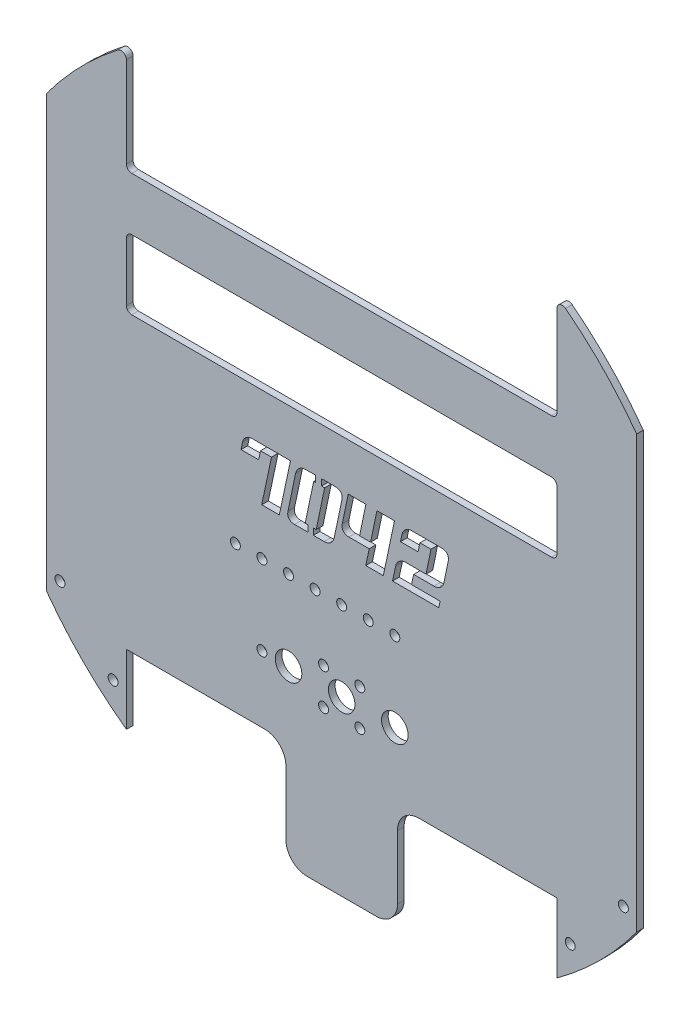
from build123d import *

# Parameters (mm, degrees)
SKETCH1_R               = 2.38125
BOSS_EXTRUDE1_DEPTH     = 3.175
BOSS_EXTRUDE2_DEPTH     = 50.8
CUT_EXTRUDE1_DEPTH      = 209.526843613
CUT_EXTRUDE1_DEPTH_BACK = 209.526843613
SKETCH3_R               = 203.829254644
SKETCH3_R_2             = 174.625
SKETCH5_R               = 2.38125
CUT_EXTRUDE3_DEPTH      = 200.484174202
SKETCH6_W               = 205.731089426
SKETCH6_H               = 25.4
BOSS_EXTRUDE3_DEPTH     = 3.175
SKETCH8_R               = 2.38125
CUT_EXTRUDE5_DEPTH      = 200.484174202
SKETCH9_W               = 205.731089426
SKETCH9_H               = 38.1
BOSS_EXTRUDE4_DEPTH     = 3.175
SKETCH10_R              = 6.35
SKETCH10_R_2            = 2.38125
CUT_EXTRUDE6_DEPTH      = 200.484174202
SKETCH11_W              = 53.331089426
SKETCH11_H              = 50.8
BOSS_EXTRUDE5_DEPTH     = 3.175
FILLET1_R               = 10.16
SKETCH12_R              = 6.35
SKETCH12_R_2            = 2.38125
CUT_EXTRUDE7_DEPTH      = 213.327407372
FILLET2_R               = 2.54
CUT_EXTRUDE8_DEPTH      = 213.327407372
SKETCH14_W              = 2.759281453
SKETCH14_H              = 7.963584416
SKETCH14_W_2            = 2.527010149
SKETCH14_H_2            = 5.938870156
BOSS_EXTRUDE6_DEPTH     = 3.175
FILLET3_R               = 2.54


with BuildPart() as part:
    # Sketch1 → Boss-Extrude1 (new body)
    with BuildSketch(Plane.XY):
        with BuildLine():
            Line((-102.865544713, 31.75), (-102.865544713, 145.022480019))
            ThreePointArc((-102.865544713, 145.022480019), (-123.286100955, 128.114703728), (-140.965544713, 108.358457002))
            Line((-140.965544713, 108.358457002), (-140.965544713, -108.358457002))
            ThreePointArc((-140.965544713, -108.358457002), (-123.286100955, -128.114703728), (-102.865544713, -145.022480019))
            Line((-102.865544713, -145.022480019), (-102.865544713, -69.85))
            Line((-102.865544713, -69.85), (102.865544713, -69.85))
            Line((102.865544713, -69.85), (102.865544713, -145.022480019))
            ThreePointArc((102.865544713, -145.022480019), (123.286100955, -128.114703728), (140.965544713, -108.358457002))
            Line((140.965544713, -108.358457002), (140.965544713, 108.358457002))
            ThreePointArc((140.965544713, 108.358457002), (123.286100955, 128.114703728), (102.865544713, 145.022480019))
            Line((102.865544713, 145.022480019), (102.865544713, 31.75))
            Line((102.865544713, 31.75), (-102.865544713, 31.75))
        make_face()
        with Locations((25.4, -38.1)):
            Circle(SKETCH1_R, mode=Mode.SUBTRACT)
        with Locations((-25.4, -38.1)):
            Circle(SKETCH1_R, mode=Mode.SUBTRACT)
        with Locations((0, -38.1)):
            Circle(SKETCH1_R, mode=Mode.SUBTRACT)
    extrude(amount=BOSS_EXTRUDE1_DEPTH)

    # Sketch2 → Boss-Extrude2 (add)
    with BuildSketch(Plane.XY.offset(3.175)):
        with BuildLine():
            ThreePointArc((-102.865544713, -141.111907137), (-123.390730203, -123.566250752), (-140.965544713, -103.06602655))
            Line((-140.965544713, -103.06602655), (-140.965544713, -108.358457002))
            ThreePointArc((-140.965544713, -108.358457002), (-123.286100955, -128.114703728), (-102.865544713, -145.022480019))
            Line((-102.865544713, -145.022480019), (-102.865544713, -141.111907137))
        make_face()
        with BuildLine():
            ThreePointArc((140.965544713, -103.06602655), (123.390730203, -123.566250752), (102.865544713, -141.111907137))
            Line((102.865544713, -141.111907137), (102.865544713, -145.022480019))
            ThreePointArc((102.865544713, -145.022480019), (123.286100955, -128.114703728), (140.965544713, -108.358457002))
            Line((140.965544713, -108.358457002), (140.965544713, -103.06602655))
        make_face()
    extrude(amount=BOSS_EXTRUDE2_DEPTH)

    # Sketch3 → Cut-Extrude1 (cut, two sides: drawn at the far end of the back side and taken through both)
    with BuildSketch(Plane.XY.offset(3.175).offset(-CUT_EXTRUDE1_DEPTH_BACK)):
        Circle(SKETCH3_R)
        Circle(SKETCH3_R_2, mode=Mode.SUBTRACT)
    extrude(amount=CUT_EXTRUDE1_DEPTH + CUT_EXTRUDE1_DEPTH_BACK, mode=Mode.SUBTRACT)

    # Sketch5 → Cut-Extrude3 (cut, through all)
    with BuildSketch(Plane.XY.offset(3.175)):
        with Locations((134.615544713, -95.585904409)):
            Circle(SKETCH5_R)
        with Locations((109.215544713, -123.814275401)):
            Circle(SKETCH5_R)
        with Locations(Location((-134.615544713, -95.585904409, 0), (0, 0, 180))):
            Circle(SKETCH5_R)
        with Locations(Location((-109.215544713, -123.814275401, 0), (0, 0, 180))):
            Circle(SKETCH5_R)
    extrude(amount=-CUT_EXTRUDE3_DEPTH, mode=Mode.SUBTRACT)

    # Sketch6 → Boss-Extrude3 (add)
    with BuildSketch(Plane.XY.offset(3.175)):
        with Locations((0, 77.611907137)):
            Rectangle(SKETCH6_W, SKETCH6_H)
    extrude(amount=-BOSS_EXTRUDE3_DEPTH)

    # Sketch8 → Cut-Extrude5 (cut, through all)
    with BuildSketch(Plane.XY.offset(3.175)):
        with Locations((-38.1, -38.1)):
            Circle(SKETCH8_R)
        with Locations((-50.8, -38.1)):
            Circle(SKETCH8_R)
        with Locations((12.7, -38.1)):
            Circle(SKETCH8_R)
        with Locations((-12.7, -38.1)):
            Circle(SKETCH8_R)
    extrude(amount=-CUT_EXTRUDE5_DEPTH, mode=Mode.SUBTRACT)

    # Sketch9 → Boss-Extrude4 (add)
    with BuildSketch(Plane.XY.offset(3.175)):
        with Locations((0, -88.9)):
            Rectangle(SKETCH9_W, SKETCH9_H)
    extrude(amount=-BOSS_EXTRUDE4_DEPTH)

    # Sketch10 → Cut-Extrude6 (cut, through all)
    with BuildSketch(Plane.XY.offset(3.175)):
        with Locations((0, -76.2)):
            Circle(SKETCH10_R)
        with Locations((-25.4, -76.2)):
            Circle(SKETCH10_R_2)
        with Locations((-38.1, -76.2)):
            Circle(SKETCH10_R_2)
        with Locations((25.4, -76.2)):
            Circle(SKETCH10_R_2)
    extrude(amount=-CUT_EXTRUDE6_DEPTH, mode=Mode.SUBTRACT)

    # Sketch11 → Boss-Extrude5 (add)
    with BuildSketch(Plane.XY.offset(3.175)):
        with Locations((0, -133.35)):
            Rectangle(SKETCH11_W, SKETCH11_H)
    extrude(amount=-BOSS_EXTRUDE5_DEPTH)

    # Fillet1
    fillet1_edges = [part.edges().sort_by_distance(p)[0] for p in [
        (-26.665544713, -158.75, 1.5875),
        (-26.665544713, -107.95, 1.5875),
        (26.665544713, -107.95, 1.5875),
        (26.665544713, -158.75, 1.5875),
    ]]
    fillet(fillet1_edges, radius=FILLET1_R)

    # Sketch12 → Cut-Extrude7 (cut, through all)
    with BuildSketch(Plane.XY.offset(3.175)):
        with Locations((-25.4, -76.2)):
            Circle(SKETCH12_R)
        with Locations((25.4, -76.2)):
            Circle(SKETCH12_R)
        with Locations((-8.66775, -67.53225)):
            Circle(SKETCH12_R_2)
        with Locations((8.66775, -67.53225)):
            Circle(SKETCH12_R_2)
        with Locations((8.66775, -84.86775)):
            Circle(SKETCH12_R_2)
        with Locations((-8.66775, -84.86775)):
            Circle(SKETCH12_R_2)
    extrude(amount=-CUT_EXTRUDE7_DEPTH, mode=Mode.SUBTRACT)

    # Fillet2
    fillet2_edges = [part.edges().sort_by_distance(p)[0] for p in [
        (-102.865544713, 141.111907137, 1.5875),
        (102.865544713, 141.111907137, 1.5875),
    ]]
    fillet(fillet2_edges, radius=FILLET2_R)

    # Sketch13 → Cut-Extrude8 (cut, through all)
    # profile 1 of 4: a face of its own
    with BuildSketch(Plane.XY.offset(3.175)):
        with BuildLine():
            Line((-29.807958333, -15.810565048), (-38.216416667, -15.810565048))
            Line((-38.216416667, -15.810565048), (-33.538583333, 6.245101619))
            Line((-33.538583333, 6.245101619), (-38.803791667, 6.245101619))
            Line((-38.803791667, 6.245101619), (-39.682208333, 2.075268285))
            Line((-39.682208333, 2.075268285), (-48.095958333, 2.075268285))
            Line((-48.095958333, 2.075268285), (-47.397458333, 5.477809952))
            add(Edge.make_bspline(
                [(-47.397458333, 5.477809952), (-47.320569058, 5.758194134), (-47.170922216, 6.303895823), (-46.789013651, 7.053374007), (-46.29771223, 7.715065901), (-45.690436731, 8.272796577), (-45.006500067, 8.730292102), (-44.253147871, 9.054960677), (-43.448405111, 9.260244914), (-42.891974442, 9.282012228), (-42.6085, 9.293101619)],
                knots=[0, 0, 0, 0, 1.050168006, 2.043904372, 3.024673376, 4.01863537, 5.013909092, 5.989008141, 6.975497172, 8, 8, 8, 8], degree=3))
            Line((-42.6085, 9.293101619), (-24.463375, 9.293101619))
            Line((-24.463375, 9.293101619), (-29.807958333, -15.810565048))
        make_face()
    # profile 2 of 4: a face of its own
    with BuildSketch(Plane.XY.offset(3.175)):
        with BuildLine():
            add(Edge.make_bspline(
                [(-3.566583333, -12.132856715), (-3.643765668, -12.421811436), (-3.79437451, -12.985659844), (-4.17293599, -13.764550451), (-4.665381385, -14.453577746), (-5.270434906, -15.036263062), (-5.950809803, -15.518035961), (-6.703009887, -15.859816489), (-7.511777843, -16.068702787), (-8.070292693, -16.093985699), (-8.355541667, -16.106898381)],
                knots=[0, 0, 0, 0, 1.062369753, 2.073042759, 3.062499936, 4.061251344, 5.048575831, 6.014824268, 6.986115874, 8, 8, 8, 8], degree=3))
            Line((-8.355541667, -16.106898381), (-22.547791667, -16.106898381))
            add(Edge.make_bspline(
                [(-22.547791667, -16.106898381), (-22.69262218, -16.104596964), (-22.972752339, -16.100145578), (-23.378206431, -16.044702396), (-23.755568174, -15.960682303), (-24.107157142, -15.846746121), (-24.426210233, -15.691540895), (-24.716954418, -15.504453058), (-24.976786635, -15.281711317), (-25.203806964, -15.025677099), (-25.40308213, -14.746169713), (-25.554358436, -14.435544628), (-25.674211179, -14.106195373), (-25.74344938, -13.752832717), (-25.791514529, -13.37950469), (-25.77975916, -12.981941289), (-25.73922686, -12.562383844), (-25.682974686, -12.278883611), (-25.654, -12.132856715)],
                knots=[0, 0, 0, 0, 1.158779845, 2.241303809, 3.269110906, 4.251580925, 5.192683609, 6.101443689, 7.012833415, 7.922909267, 8.835720222, 9.751475912, 10.680528402, 11.633319635, 12.628295421, 13.687540584, 14.808885378, 16, 16, 16, 16], degree=3))
            Line((-25.654, -12.132856715), (-21.997458333, 5.319059952))
            add(Edge.make_bspline(
                [(-21.997458333, 5.319059952), (-21.920272116, 5.608009048), (-21.769655695, 6.171846477), (-21.391148554, 6.950815808), (-20.898502375, 7.639552216), (-20.293153244, 8.224337096), (-19.608609326, 8.702683082), (-18.855913228, 9.046275843), (-18.048644228, 9.254382857), (-17.4919553, 9.28003834), (-17.2085, 9.293101619)],
                knots=[0, 0, 0, 0, 1.062516124, 2.073328378, 3.062921881, 4.061810895, 5.05442655, 6.020808115, 6.992233544, 8, 8, 8, 8], degree=3))
            Line((-17.2085, 9.293101619), (-3.01625, 9.293101619))
            add(Edge.make_bspline(
                [(-3.01625, 9.293101619), (-2.871419505, 9.290800192), (-2.591289383, 9.286348788), (-2.185835038, 9.230905733), (-1.808474182, 9.146885197), (-1.456882118, 9.03295056), (-1.137839887, 8.877739913), (-0.847056821, 8.690671483), (-0.587369032, 8.467857656), (-0.359809395, 8.212092615), (-0.16209325, 7.930921186), (-0.002983257, 7.623293687), (0.114459046, 7.2921344), (0.187047795, 6.939473562), (0.223589985, 6.565305639), (0.223678302, 6.168188246), (0.179743785, 5.748571863), (0.123975462, 5.465081675), (0.09525, 5.319059952)],
                knots=[0, 0, 0, 0, 1.158432062, 2.24063113, 3.268129752, 4.250304904, 5.191125136, 6.099612471, 7.010728663, 7.920531375, 8.833068369, 9.75494936, 10.683723015, 11.636228288, 12.62940148, 13.688234619, 14.809242866, 16, 16, 16, 16], degree=3))
            Line((0.09525, 5.319059952), (-3.566583333, -12.132856715))
        make_face()
        Polygon((-13.403791667, 6.245101619), (-17.425458333, -13.058898381), (-12.16025, -13.058898381), (-8.138583333, 6.245101619), align=None, mode=Mode.SUBTRACT)
    # profile 3 of 4: a face of its own
    with BuildSketch(Plane.XY.offset(3.175)):
        with BuildLine():
            Line((11.557, 9.293101619), (8.556625, -5.269565048))
            Line((8.556625, -5.269565048), (13.827125, -5.269565048))
            Line((13.827125, -5.269565048), (16.8275, 9.293101619))
            Line((16.8275, 9.293101619), (25.235958333, 9.293101619))
            Line((25.235958333, 9.293101619), (19.896666667, -16.106898381))
            Line((19.896666667, -16.106898381), (11.482916667, -16.106898381))
            Line((11.482916667, -16.106898381), (13.165666667, -8.317565048))
            Line((13.165666667, -8.317565048), (3.439583333, -8.317565048))
            add(Edge.make_bspline(
                [(3.439583333, -8.317565048), (3.294736233, -8.315312365), (3.014573993, -8.310955241), (2.609344629, -8.25485176), (2.230636814, -8.173029355), (1.881290806, -8.050712181), (1.561052368, -7.897312045), (1.270346477, -7.709804396), (1.009103929, -7.48515858), (0.777806767, -7.227358437), (0.580756638, -6.941550122), (0.426179112, -6.6292081), (0.309007624, -6.297036788), (0.237889907, -5.94070984), (0.190785312, -5.563660832), (0.202000265, -5.162620664), (0.243321079, -4.739613917), (0.29915982, -4.45427987), (0.328083333, -4.306481715)],
                knots=[0, 0, 0, 0, 1.152191709, 2.228561082, 3.250524676, 4.231939746, 5.167691878, 6.071285285, 6.977493388, 7.902223819, 8.821393841, 9.731943086, 10.66895861, 11.616332835, 12.619603957, 13.686867372, 14.801836863, 16, 16, 16, 16], degree=3))
            Line((0.328083333, -4.306481715), (3.14325, 9.293101619))
            Line((3.14325, 9.293101619), (11.557, 9.293101619))
        make_face()
    # profile 4 of 4: a face of its own
    with BuildSketch(Plane.XY.offset(3.175)):
        with BuildLine():
            Line((33.374541667, -13.058898381), (47.0535, -13.058898381))
            Line((47.0535, -13.058898381), (46.392041667, -16.106898381))
            Line((46.392041667, -16.106898381), (24.304625, -16.106898381))
            Line((24.304625, -16.106898381), (25.802166667, -9.143065048))
            add(Edge.make_bspline(
                [(25.802166667, -9.143065048), (25.879273752, -8.861031474), (26.029757165, -8.310610268), (26.410334887, -7.552072135), (26.901419327, -6.879703753), (27.508831265, -6.311820899), (28.191228528, -5.842472815), (28.946271137, -5.513745702), (29.752164487, -5.300517366), (30.311046908, -5.28002739), (30.596416667, -5.269565048)],
                knots=[0, 0, 0, 0, 1.049169808, 2.047576474, 3.031944376, 4.027910562, 5.023553593, 5.994653504, 6.976054309, 8, 8, 8, 8], degree=3))
            Line((30.596416667, -5.269565048), (40.3225, -5.269565048))
            Line((40.3225, -5.269565048), (42.661416667, 6.245101619))
            Line((42.661416667, 6.245101619), (37.396208333, 6.245101619))
            Line((37.396208333, 6.245101619), (36.517791667, 2.075268285))
            Line((36.517791667, 2.075268285), (28.104041667, 2.075268285))
            Line((28.104041667, 2.075268285), (28.802541667, 5.477809952))
            add(Edge.make_bspline(
                [(28.802541667, 5.477809952), (28.879430942, 5.758194134), (29.029077784, 6.303895823), (29.410986349, 7.053374007), (29.90228777, 7.715065901), (30.509563269, 8.272796577), (31.193499933, 8.730292102), (31.946852129, 9.054960677), (32.751594889, 9.260244914), (33.308025558, 9.282012228), (33.5915, 9.293101619)],
                knots=[0, 0, 0, 0, 1.050168006, 2.043904372, 3.024673376, 4.01863537, 5.013909092, 5.989008141, 6.975497172, 8, 8, 8, 8], degree=3))
            Line((33.5915, 9.293101619), (47.78375, 9.293101619))
            add(Edge.make_bspline(
                [(47.78375, 9.293101619), (47.92859726, 9.290849086), (48.208759811, 9.286492252), (48.613987002, 9.230386738), (48.992702458, 9.148571481), (49.342021711, 9.026229282), (49.662353678, 8.87291663), (49.952725098, 8.685096123), (50.214324347, 8.462382804), (50.440285412, 8.20121114), (50.636405741, 7.915869715), (50.798510828, 7.606235104), (50.913345969, 7.272328086), (50.987754572, 6.916671215), (51.023365934, 6.538801464), (51.023963511, 6.138199286), (50.97928388, 5.715135649), (50.923924969, 5.429811378), (50.89525, 5.282018285)],
                knots=[0, 0, 0, 0, 1.152517565, 2.229191352, 3.251443972, 4.233136601, 5.169153376, 6.073002333, 6.979466726, 7.895134038, 8.814564014, 9.731738245, 10.66901877, 11.616660927, 12.618740334, 13.686213184, 14.801498005, 16, 16, 16, 16], degree=3))
            Line((50.89525, 5.282018285), (48.916166667, -4.306481715))
            add(Edge.make_bspline(
                [(48.916166667, -4.306481715), (48.838706266, -4.597052385), (48.687148602, -5.165577869), (48.311448965, -5.952788492), (47.817473721, -6.648200027), (47.212376239, -7.235653604), (46.533647997, -7.724482215), (45.778706123, -8.063324207), (44.971906745, -8.281163221), (44.41262475, -8.30526518), (44.127208333, -8.317565048)],
                knots=[0, 0, 0, 0, 1.06412456, 2.082047477, 3.072647496, 4.071792832, 5.058775816, 6.021176094, 6.990153746, 8, 8, 8, 8], degree=3))
            Line((44.127208333, -8.317565048), (34.395833333, -8.317565048))
            Line((34.395833333, -8.317565048), (33.374541667, -13.058898381))
        make_face()
    extrude(amount=-CUT_EXTRUDE8_DEPTH, mode=Mode.SUBTRACT)


with BuildPart() as cut_extrude8_piece_1:
    # of the separate pieces the step leaves, piece 1, a body of its own (cut_extrude8_pieces)
    add(part.part.solids().sort_by_distance((-106.961346111, 138.033188267, 0))[0])



with BuildPart() as cut_extrude8_piece_2:
    # of the separate pieces the step leaves, piece 2, a body of its own (cut_extrude8_pieces)
    add(part.part.solids().sort_by_distance((-8.138583333, 6.245101619, 0))[0])


with BuildPart() as cut_extrude8_piece_1_1:
    add(cut_extrude8_piece_1.part)

    add(cut_extrude8_piece_2.part)  # Boss-Extrude6 merges Cut-Extrude8 piece 2
    # Sketch14 → Boss-Extrude6 (add)
    with BuildSketch(Plane.XY.offset(3.175)):
        with Locations((-11.017521916, 7.88967512)):
            Rectangle(SKETCH14_W, SKETCH14_H)
        with Locations((-14.795211944, -14.779945163)):
            Rectangle(SKETCH14_W_2, SKETCH14_H_2)
    extrude(amount=-BOSS_EXTRUDE6_DEPTH)

    # Fillet3
    fillet3_edges = [cut_extrude8_piece_1_1.edges().sort_by_distance(p)[0] for p in [
        (102.865544713, 90.311907137, 1.5875),
        (102.865544713, 31.75, 1.5875),
        (-102.865544713, 64.911907137, 1.5875),
        (-102.865544713, 31.75, 1.5875),
        (-102.865544713, 90.311907137, 1.5875),
        (102.865544713, 64.911907137, 1.5875),
    ]]
    fillet(fillet3_edges, radius=FILLET3_R)


solid = cut_extrude8_piece_1_1.part
